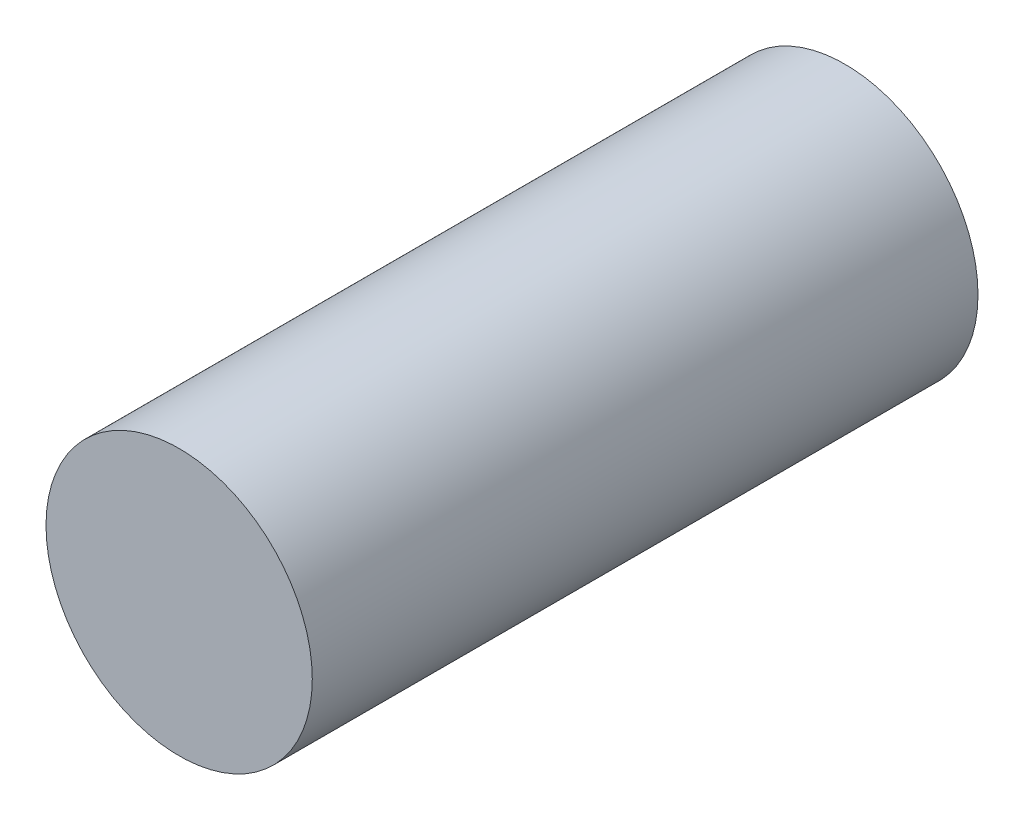
from build123d import *

# Parameters (mm, degrees)
TOPPING_KAT2_KAPAK_PIMI_D8_1_START = -40
SKETCH1_R                          = 4
TOPPING_KAT2_KAPAK_PIMI_D8_1_DEPTH = 20


with BuildPart() as part:
    # Sketch1 → TOPPING_kat2_kapak_pimi_D8_1 (new body)
    with BuildSketch(Plane.XY.offset(TOPPING_KAT2_KAPAK_PIMI_D8_1_START)):
        with Locations((300, 1334)):
            Circle(SKETCH1_R)
    extrude(amount=-TOPPING_KAT2_KAPAK_PIMI_D8_1_DEPTH)


solid = part.part
